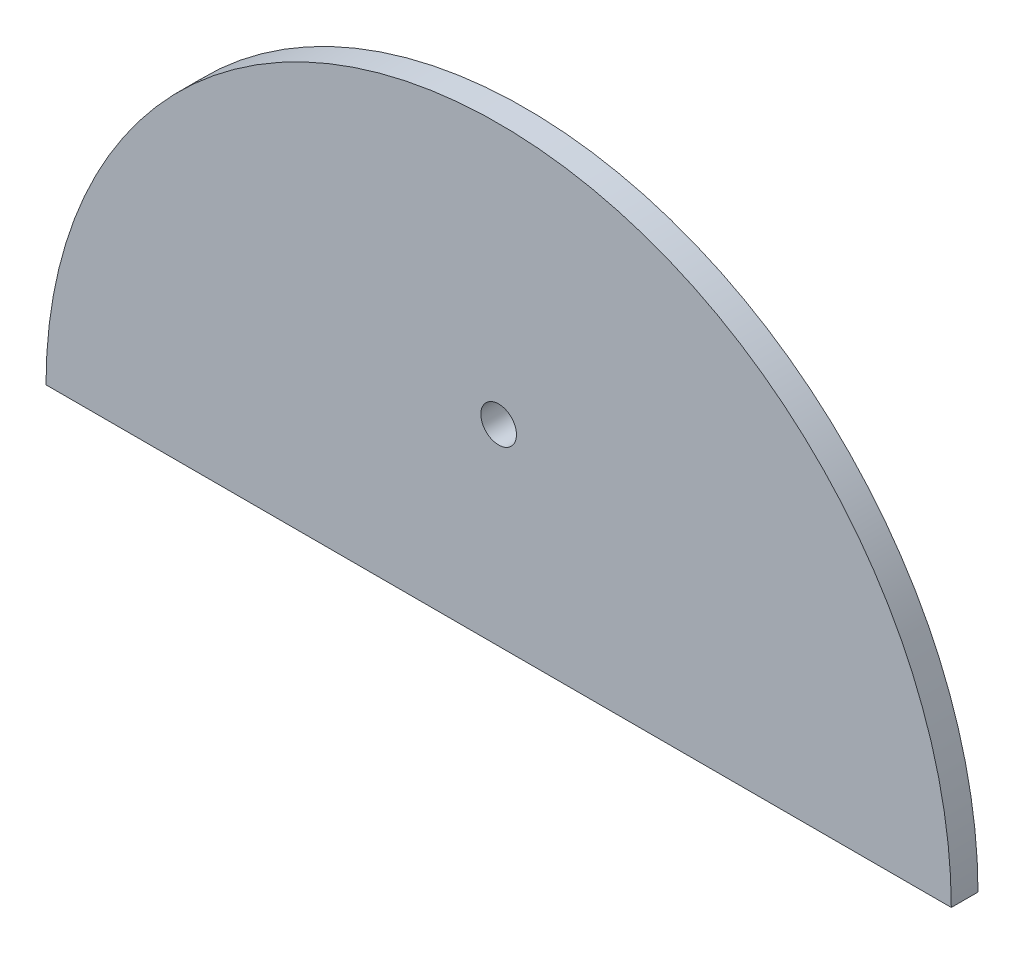
from build123d import *

# Parameters (mm, degrees)
BOSS_EXTRUDE1_DEPTH = 3
SKETCH2_R           = 2
CUT_EXTRUDE1_DEPTH  = 72.975308266


with BuildPart() as part:
    # Sketch1 → Boss-Extrude1 (new body)
    with BuildSketch(Plane.XY):
        with BuildLine():
            Line((-50.85, 0), (50.85, 0))
            ThreePointArc((50.85, 0), (0, 50.85), (-50.85, 0))
        make_face()
    extrude(amount=BOSS_EXTRUDE1_DEPTH)

    # Sketch2 → Cut-Extrude1 (cut, through all)
    with BuildSketch(Plane.XY.offset(3)):
        with Locations((0, 21.572727273)):
            Circle(SKETCH2_R)
    extrude(amount=-CUT_EXTRUDE1_DEPTH, mode=Mode.SUBTRACT)


solid = part.part
